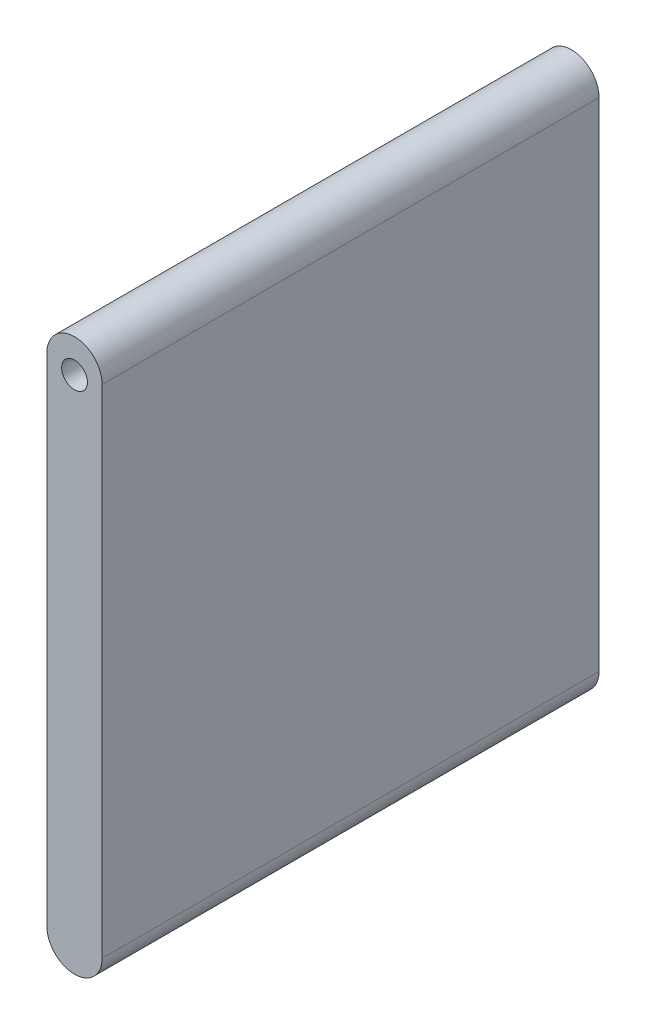
from build123d import *

# Parameters (mm, degrees)
BOSS_EXTRUDE1_DEPTH = 135
SKETCH3_R           = 3.25
CUT_EXTRUDE2_DEPTH  = 10
SKETCH6_W           = 11
SKETCH6_H           = 36
CUT_EXTRUDE3_DEPTH  = 40
SKETCH7_W           = 55
SKETCH7_H           = 16.435142828
BOSS_EXTRUDE2_DEPTH = 35
CUT_EXTRUDE4_DEPTH  = 20
CUT_EXTRUDE5_DEPTH  = 20
SKETCH12_R          = 3.5
CUT_EXTRUDE6_DEPTH  = 10
CUT_EXTRUDE7_DEPTH  = 120
SKETCH14_W          = 10
SKETCH14_H          = 112.990035736
BOSS_EXTRUDE3_DEPTH = 9


with BuildPart() as part:
    # Sketch2 → Boss-Extrude1 (new body)
    with BuildSketch(Plane.XY):
        with BuildLine():
            Line((-7.403081865, 56.261800555), (-7.403081865, -78.738199445))
            ThreePointArc((-7.403081865, -78.738199445), (0.096918135, -86.238199445), (7.596918135, -78.738199445))
            Line((7.596918135, -78.738199445), (7.596918135, 56.261800555))
            ThreePointArc((7.596918135, 56.261800555), (0.096918135, 63.761800555), (-7.403081865, 56.261800555))
        make_face()
    extrude(amount=BOSS_EXTRUDE1_DEPTH)

    # Sketch3 → Cut-Extrude2 (cut)
    with BuildSketch(Plane(origin=(0, 0, 0), x_dir=(-1, 0, 0), z_dir=(0, 0, -1))):
        with Locations((-0.096918135, 54.761800555)):
            Circle(SKETCH3_R)
    extrude(amount=-CUT_EXTRUDE2_DEPTH, mode=Mode.SUBTRACT)

    # Sketch6 → Cut-Extrude3 (cut)
    with BuildSketch(Plane(origin=(0, 0, 0), x_dir=(-1, 0, 0), z_dir=(0, 0, -1))):
        with Locations((-0.096918135, -48.578199445)):
            Rectangle(SKETCH6_W, SKETCH6_H)
    extrude(amount=-CUT_EXTRUDE3_DEPTH, mode=Mode.SUBTRACT)

    # Sketch7 → Boss-Extrude2 (add)
    with BuildSketch(Plane.ZY.offset(7.403081865)):
        with Locations((67.5, -49.750557846)):
            Rectangle(SKETCH7_W, SKETCH7_H)
    extrude(amount=BOSS_EXTRUDE2_DEPTH)

    # Sketch10 → Cut-Extrude4 (cut)
    with BuildSketch(Plane(origin=(0, -41.532986432, 0), x_dir=(1, 0, 0), z_dir=(0, 1, 0))):
        with BuildLine():
            Line((-7.403081865, -40), (-42.403081865, -40))
            Line((-42.403081865, -40), (-42.403081865, -95))
            Line((-42.403081865, -95), (-7.403081865, -95))
            ThreePointArc((-7.403081865, -95), (-33.21161021, -67.5), (-7.403081865, -40))
        make_face()
    extrude(amount=-CUT_EXTRUDE4_DEPTH, mode=Mode.SUBTRACT)

    # Sketch11 → Cut-Extrude5 (cut)
    with BuildSketch(Plane(origin=(0, -41.532986432, 0), x_dir=(1, 0, 0), z_dir=(0, 1, 0))):
        with BuildLine():
            Line((-7.569996139, -52.041059143), (-7.569996139, -82.958940857))
            ThreePointArc((-7.569996139, -82.958940857), (-23.028936996, -67.5), (-7.569996139, -52.041059143))
        make_face()
    extrude(amount=-CUT_EXTRUDE5_DEPTH, mode=Mode.SUBTRACT)

    # Sketch12 → Cut-Extrude6 (cut)
    with BuildSketch(Plane.XY.offset(135)):
        with Locations((0.096918135, 54.761800555)):
            Circle(SKETCH12_R)
    extrude(amount=-CUT_EXTRUDE6_DEPTH, mode=Mode.SUBTRACT)

    # Sketch13 → Cut-Extrude7 (cut)
    with BuildSketch(Plane.XY.offset(135)):
        Polygon((4.403081865, 46.751836291), (-4.403081865, 46.751836291), (-4.403081865, -46.751836291), (-4.403081865, -66.238199445), (4.403081865, -66.238199445), (4.403081865, -46.751836291), align=None)
    extrude(amount=-CUT_EXTRUDE7_DEPTH, mode=Mode.SUBTRACT)

    # Sketch14 → Boss-Extrude3 (add)
    with BuildSketch(Plane.ZY.offset(-4.403081865)):
        with Locations((130, -9.743181577)):
            Rectangle(SKETCH14_W, SKETCH14_H)
    extrude(amount=BOSS_EXTRUDE3_DEPTH)


solid = part.part
